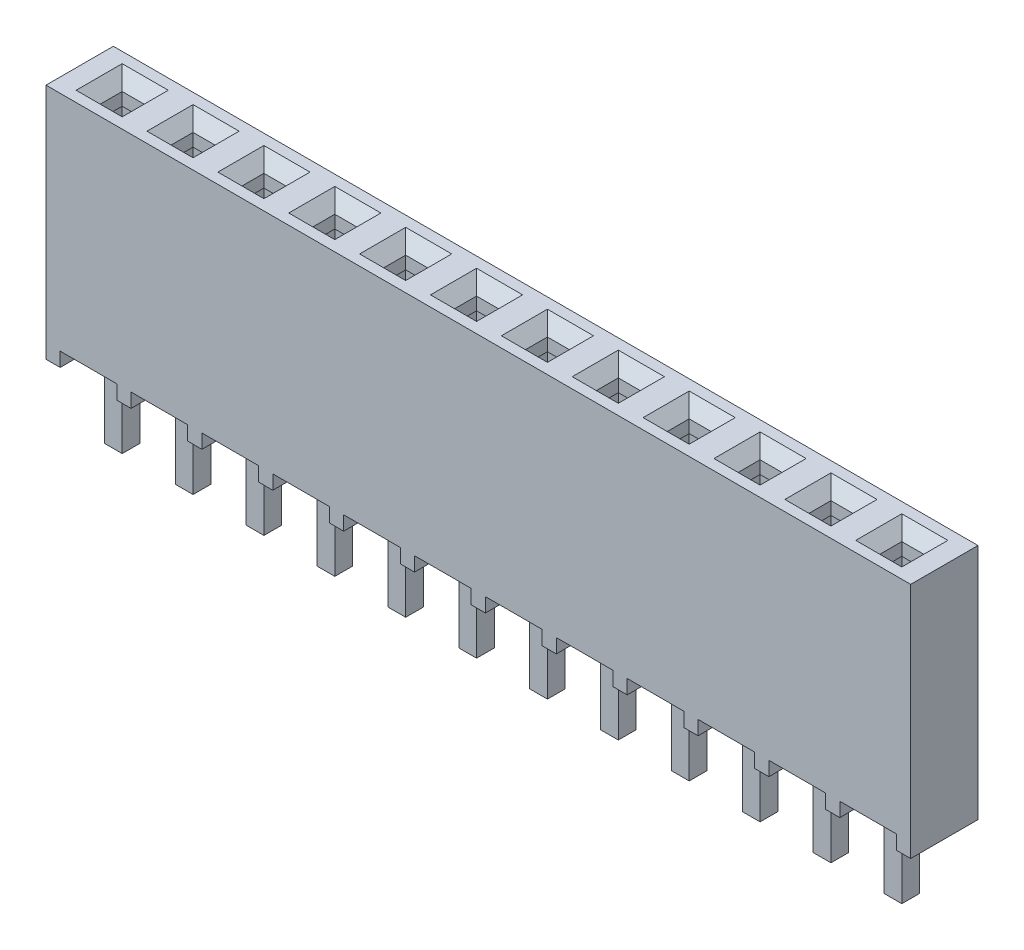
from build123d import *

# Parameters (mm, degrees)
SKETCH1_W                                     = 30.988
SKETCH1_H                                     = 2.413
BASE_EXTRUDE_DEPTH                            = 8.509
SKETCH2_W                                     = 0.7874
SKETCH2_H                                     = 0.7874
OPENING_DEPTH                                 = 0.889
LEAD_IN_SIZE                                  = 0.4318
SKETCH3_W                                     = 1.016
SKETCH3_H                                     = 1.016
CORE_DEPTH                                    = 18.308497285
SKETCH4_W                                     = 2.032
SKETCH4_H                                     = 0.508
STANDOFF_DEPTH                                = 18.840675043
BODY_WIDTH_POS_PATTERN_COUNT                  = 12
BODY_WIDTH_POS_PATTERN_PITCH                  = 2.54
LEAD_IN_OF_BODY_WIDTH_POS_PATTERN_SIZE        = 0.4318
STANDOFF_PATTERN_COUNT                        = 12
STANDOFF_PATTERN_PITCH                        = 2.54
STRAIGHT_TAIL_DEPTH                           = 0.3175
STRAIGHT_TAIL_TIP_SIZE                        = 0.1905
STRAIGHT_TAIL_POS_PATTERN_COUNT               = 12
STRAIGHT_TAIL_POS_PATTERN_PITCH               = 2.54
STRAIGHT_TAIL_TIP_OF_STRAIGHT_TAIL_POS_P_SIZE = 0.1905


with BuildPart() as part:
    # Sketch1 → Base-Extrude (new body)
    with BuildSketch(Plane(origin=(0, 0, 0), x_dir=(1, 0, 0), z_dir=(0, 1, 0))):
        Rectangle(SKETCH1_W, SKETCH1_H)
    extrude(amount=-BASE_EXTRUDE_DEPTH)

    # Sketch2 → Opening (cut)
    with BuildSketch(Plane(origin=(0, 0, 0), x_dir=(-1, 0, 0), z_dir=(0, 1, 0))):
        with Locations((13.97, 0)):
            Rectangle(SKETCH2_W, SKETCH2_H)
    opening = extrude(amount=-OPENING_DEPTH, mode=Mode.SUBTRACT)

    # Lead-in
    lead_in_edges = [part.edges().sort_by_distance(p)[0] for p in [
        (-14.3637, 0, 0),
        (-13.97, 0, 0.3937),
        (-13.5763, 0, 0),
        (-13.97, 0, -0.3937),
    ]]
    chamfer(lead_in_edges, length=LEAD_IN_SIZE)

    # Sketch3 → Core (cut, through all)
    with BuildSketch(Plane(origin=(0, -0.889, 0), x_dir=(-1, 0, 0), z_dir=(0, 1, 0))):
        with Locations((13.97, 0)):
            Rectangle(SKETCH3_W, SKETCH3_H)
    core = extrude(amount=-CORE_DEPTH, mode=Mode.SUBTRACT)

    # Sketch4 → Standoff (cut, through all)
    with BuildSketch(Plane.XY.offset(1.2065)):
        with Locations((-13.97, -8.255)):
            Rectangle(SKETCH4_W, SKETCH4_H)
    standoff = extrude(amount=-STANDOFF_DEPTH, mode=Mode.SUBTRACT)

    # Body Width Pos Pattern: Opening, Core ×12
    with Locations(*[(i * BODY_WIDTH_POS_PATTERN_PITCH, 0, 0) for i in range(1, BODY_WIDTH_POS_PATTERN_COUNT)]):
        add(opening, mode=Mode.SUBTRACT)
        add(core, mode=Mode.SUBTRACT)

    # Lead-in of Body Width Pos Pattern
    lead_in_of_body_width_pos_pattern_edges = [part.edges().sort_by_distance(p)[0] for p in [
        (-11.8237, 0, 0),
        (-11.43, 0, 0.3937),
        (-11.0363, 0, 0),
        (-11.43, 0, -0.3937),
        (-9.2837, 0, 0),
        (-8.89, 0, 0.3937),
        (-8.4963, 0, 0),
        (-8.89, 0, -0.3937),
        (-6.7437, 0, 0),
        (-6.35, 0, 0.3937),
        (-5.9563, 0, 0),
        (-6.35, 0, -0.3937),
        (-4.2037, 0, 0),
        (-3.81, 0, 0.3937),
        (-3.4163, 0, 0),
        (-3.81, 0, -0.3937),
        (-1.6637, 0, 0),
        (-1.27, 0, 0.3937),
        (-0.8763, 0, 0),
        (-1.27, 0, -0.3937),
        (0.8763, 0, 0),
        (1.27, 0, 0.3937),
        (1.6637, 0, 0),
        (1.27, 0, -0.3937),
        (3.4163, 0, 0),
        (3.81, 0, 0.3937),
        (4.2037, 0, 0),
        (3.81, 0, -0.3937),
        (5.9563, 0, 0),
        (6.35, 0, 0.3937),
        (6.7437, 0, 0),
        (6.35, 0, -0.3937),
        (8.4963, 0, 0),
        (8.89, 0, 0.3937),
        (9.2837, 0, 0),
        (8.89, 0, -0.3937),
        (11.0363, 0, 0),
        (11.43, 0, 0.3937),
        (11.8237, 0, 0),
        (11.43, 0, -0.3937),
        (13.5763, 0, 0),
        (13.97, 0, 0.3937),
        (14.3637, 0, 0),
        (13.97, 0, -0.3937),
    ]]
    chamfer(lead_in_of_body_width_pos_pattern_edges, length=LEAD_IN_OF_BODY_WIDTH_POS_PATTERN_SIZE)

    # Standoff Pattern: Standoff ×12
    with Locations(*[(i * STANDOFF_PATTERN_PITCH, 0, 0) for i in range(1, STANDOFF_PATTERN_COUNT)]):
        add(standoff, mode=Mode.SUBTRACT)

    # Sketch6 → Straight Tail (add, symmetric)
    with BuildSketch(Plane(origin=(0, 0, 0), x_dir=(-1, 0, 0), z_dir=(0, 0, -1))):
        Polygon((13.6525, -8.001), (13.462, -8.001), (13.462, -7.366), (14.478, -7.366), (14.478, -8.001), (14.2875, -8.001), (14.2875, -11.1506), (13.6525, -11.1506), align=None)
    straight_tail = extrude(amount=STRAIGHT_TAIL_DEPTH, both=True)

    # Straight Tail Tip
    straight_tail_tip_edges = [part.edges().sort_by_distance(p)[0] for p in [
        (-13.97, -11.1506, 0.3175),
        (-13.6525, -11.1506, 0),
        (-14.2875, -11.1506, 0),
        (-13.97, -11.1506, -0.3175),
    ]]
    chamfer(straight_tail_tip_edges, length=STRAIGHT_TAIL_TIP_SIZE)

    # Straight Tail Pos Pattern: Straight Tail ×12
    with Locations(*[(i * STRAIGHT_TAIL_POS_PATTERN_PITCH, 0, 0) for i in range(1, STRAIGHT_TAIL_POS_PATTERN_COUNT)]):
        add(straight_tail)

    # Straight Tail Tip of Straight Tail Pos P
    straight_tail_tip_of_straight_tail_pos_p_edges = [part.edges().sort_by_distance(p)[0] for p in [
        (-11.43, -11.1506, 0.3175),
        (-11.1125, -11.1506, 0),
        (-11.7475, -11.1506, 0),
        (-11.43, -11.1506, -0.3175),
        (-8.89, -11.1506, 0.3175),
        (-8.5725, -11.1506, 0),
        (-9.2075, -11.1506, 0),
        (-8.89, -11.1506, -0.3175),
        (-6.35, -11.1506, 0.3175),
        (-6.0325, -11.1506, 0),
        (-6.6675, -11.1506, 0),
        (-6.35, -11.1506, -0.3175),
        (-3.81, -11.1506, 0.3175),
        (-3.4925, -11.1506, 0),
        (-4.1275, -11.1506, 0),
        (-3.81, -11.1506, -0.3175),
        (-1.27, -11.1506, 0.3175),
        (-0.9525, -11.1506, 0),
        (-1.5875, -11.1506, 0),
        (-1.27, -11.1506, -0.3175),
        (1.27, -11.1506, 0.3175),
        (1.5875, -11.1506, 0),
        (0.9525, -11.1506, 0),
        (1.27, -11.1506, -0.3175),
        (3.81, -11.1506, 0.3175),
        (4.1275, -11.1506, 0),
        (3.4925, -11.1506, 0),
        (3.81, -11.1506, -0.3175),
        (6.35, -11.1506, 0.3175),
        (6.6675, -11.1506, 0),
        (6.0325, -11.1506, 0),
        (6.35, -11.1506, -0.3175),
        (8.89, -11.1506, 0.3175),
        (9.2075, -11.1506, 0),
        (8.5725, -11.1506, 0),
        (8.89, -11.1506, -0.3175),
        (11.43, -11.1506, 0.3175),
        (11.7475, -11.1506, 0),
        (11.1125, -11.1506, 0),
        (11.43, -11.1506, -0.3175),
        (13.97, -11.1506, 0.3175),
        (14.2875, -11.1506, 0),
        (13.6525, -11.1506, 0),
        (13.97, -11.1506, -0.3175),
    ]]
    chamfer(straight_tail_tip_of_straight_tail_pos_p_edges, length=STRAIGHT_TAIL_TIP_OF_STRAIGHT_TAIL_POS_P_SIZE)


solid = part.part
